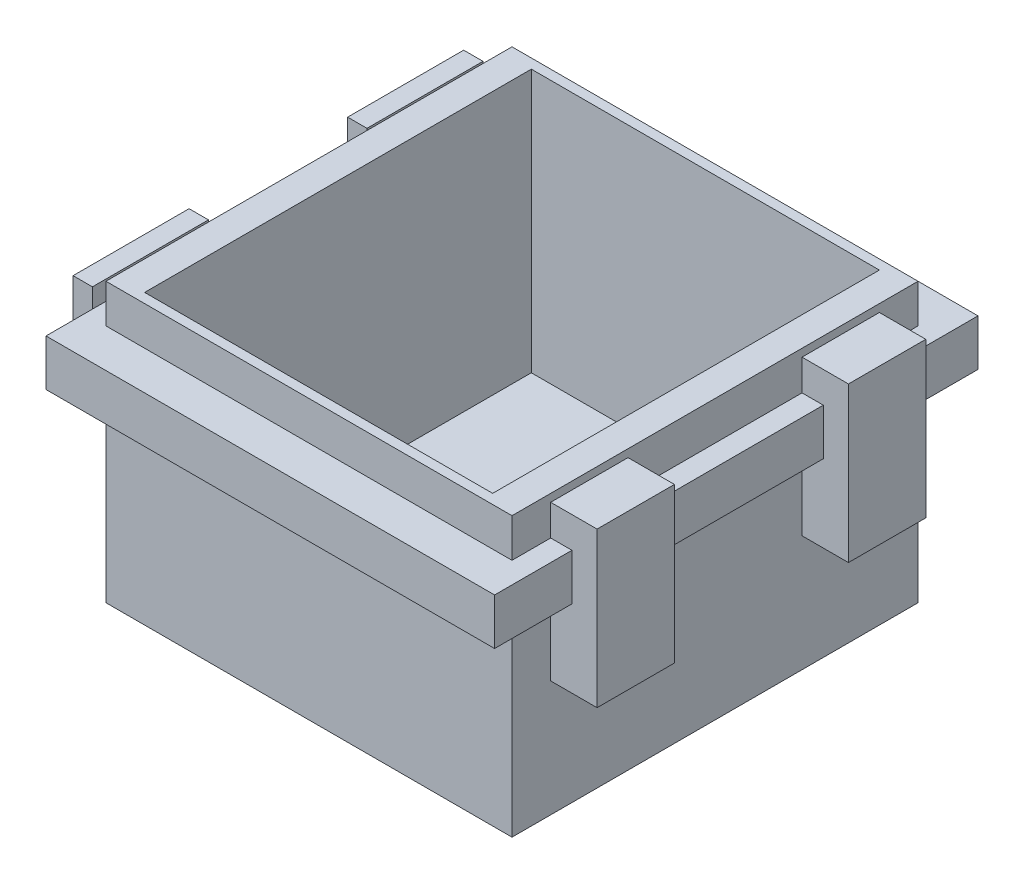
from build123d import *

# Parameters (mm, degrees)
SKETCH1_W           = 133.35
SKETCH1_H           = 133.35
BOSS_EXTRUDE1_DEPTH = 63.5
SKETCH2_W           = 147.32
SKETCH2_H           = 158.75
BOSS_EXTRUDE2_DEPTH = 15.24
SKETCH3_W           = 133.35
SKETCH3_H           = 133.35
BOSS_EXTRUDE3_DEPTH = 12.7
SKETCH4_W           = 38.1
SKETCH4_H           = 19.05
BOSS_EXTRUDE4_DEPTH = 6.35
SKETCH5_W           = 25.4
SKETCH5_H           = 50.8
BOSS_EXTRUDE5_DEPTH = 15.24
SKETCH7_W           = 114.3
SKETCH7_H           = 127
CUT_EXTRUDE1_DEPTH  = 86.36


with BuildPart() as part:
    # Sketch1 → Boss-Extrude1 (new body)
    with BuildSketch(Plane(origin=(0, 0, 0), x_dir=(1, 0, 0), z_dir=(0, 1, 0))):
        Rectangle(SKETCH1_W, SKETCH1_H)
    extrude(amount=BOSS_EXTRUDE1_DEPTH)

    # Sketch2 → Boss-Extrude2 (add)
    with BuildSketch(Plane(origin=(0, 63.5, 0), x_dir=(1, 0, 0), z_dir=(0, 1, 0))):
        Rectangle(SKETCH2_W, SKETCH2_H)
    extrude(amount=BOSS_EXTRUDE2_DEPTH)

    # Sketch3 → Boss-Extrude3 (add)
    with BuildSketch(Plane(origin=(0, 78.74, 0), x_dir=(1, 0, 0), z_dir=(0, 1, 0))):
        Rectangle(SKETCH3_W, SKETCH3_H)
    extrude(amount=BOSS_EXTRUDE3_DEPTH)

    # Sketch4 → Boss-Extrude4 (add)
    with BuildSketch(Plane.ZY.offset(73.66)):
        with Locations((45.085, 75.565)):
            Rectangle(SKETCH4_W, SKETCH4_H)
    boss_extrude4 = extrude(amount=BOSS_EXTRUDE4_DEPTH)

    # Mirror1: Boss-Extrude4 across plane
    add(boss_extrude4.mirror(Plane.XY))

    # Sketch5 → Boss-Extrude5 (add)
    with BuildSketch(Plane(origin=(66.675, 0, 0), x_dir=(0, 0, -1), z_dir=(1, 0, 0))):
        with Locations((-41.275, 63.5)):
            Rectangle(SKETCH5_W, SKETCH5_H)
    boss_extrude5 = extrude(amount=BOSS_EXTRUDE5_DEPTH)

    # Mirror2: Boss-Extrude5 across plane
    add(boss_extrude5.mirror(Plane.XY))

    # Sketch7 → Cut-Extrude1 (cut)
    with BuildSketch(Plane(origin=(0, 91.44, 0), x_dir=(1, 0, 0), z_dir=(0, 1, 0))):
        Rectangle(SKETCH7_W, SKETCH7_H)
    extrude(amount=-CUT_EXTRUDE1_DEPTH, mode=Mode.SUBTRACT)


solid = part.part
